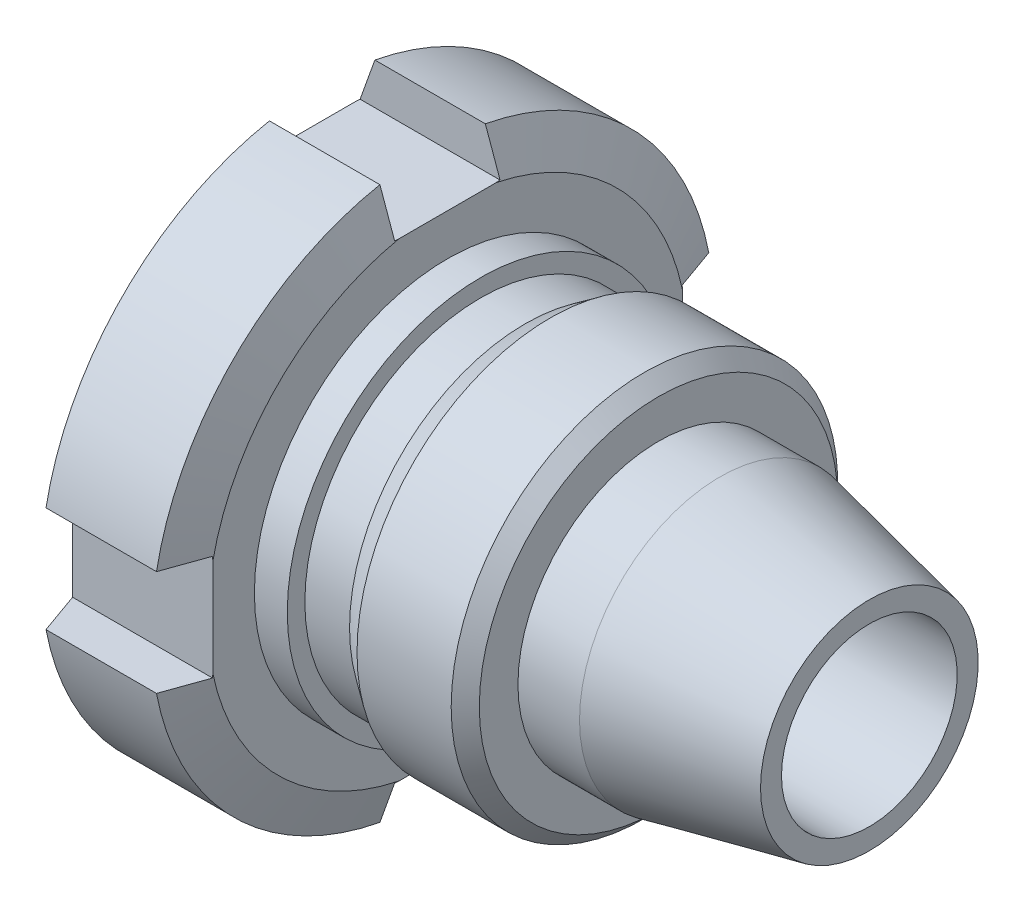
from build123d import *

# Parameters (mm, degrees)
CUT_EXTRUDE1_REACH = 64.217
CIRPATTERN1_COUNT  = 4


with BuildPart() as part:
    # Sketch1 → Revolve1 (revolve)
    with BuildSketch(Plane.XY, mode=Mode.PRIVATE) as revolve1_sk:
        Polygon((0, 6.35), (0, 21.6662), (1.358992061, 25.4), (11.341007939, 25.4), (12.7, 21.6662), (12.7, 17.4625), (15.6718, 17.4625), (15.6718, 15.875), (19.7104, 15.875), (21.971, 17.4625), (30.48, 17.4625), (31.75, 16.1925), (31.75, 12.7), (37.3126, 12.7), (50.8, 9.83316463), (50.8, 7.9375), (38.1, 7.9375), (37.146133767, 6.35), align=None)
    revolve(revolve1_sk.sketch.rotate(Axis((0, 0, 0), (1, 0, 0)), 90), axis=Axis((0, 0, 0), (1, 0, 0)))

    # Sketch2 → Cut-Extrude1 (cut, up to next)
    with BuildSketch(Plane.ZY, mode=Mode.PRIVATE) as cut_extrude1_sk1:
        with BuildLine():
            Line((-4.7625, 21.215720912), (-4.7625, 24.949520912))
            ThreePointArc((-4.7625, 24.949520912), (0, 25.4), (4.7625, 24.949520912))
            Line((4.7625, 24.949520912), (4.7625, 21.215720912))
            Line((4.7625, 21.215720912), (-4.7625, 21.215720912))
        make_face()
    cut_extrude1_tool1 = extrude(cut_extrude1_sk1.sketch, amount=-CUT_EXTRUDE1_REACH, mode=Mode.PRIVATE) & part.part
    cut_extrude1 = cut_extrude1_tool1.solids().sort_by_distance((0, 23.235279, 0))[0]
    add(cut_extrude1, mode=Mode.SUBTRACT)

    # CirPattern1: Cut-Extrude1 ×4 about axis
    cirpattern1_axis = Axis((0, 0, 0), (1, 0, 0))
    for i in range(1, CIRPATTERN1_COUNT):
        add(cut_extrude1.rotate(cirpattern1_axis, i * 360 / CIRPATTERN1_COUNT), mode=Mode.SUBTRACT)


solid = part.part
